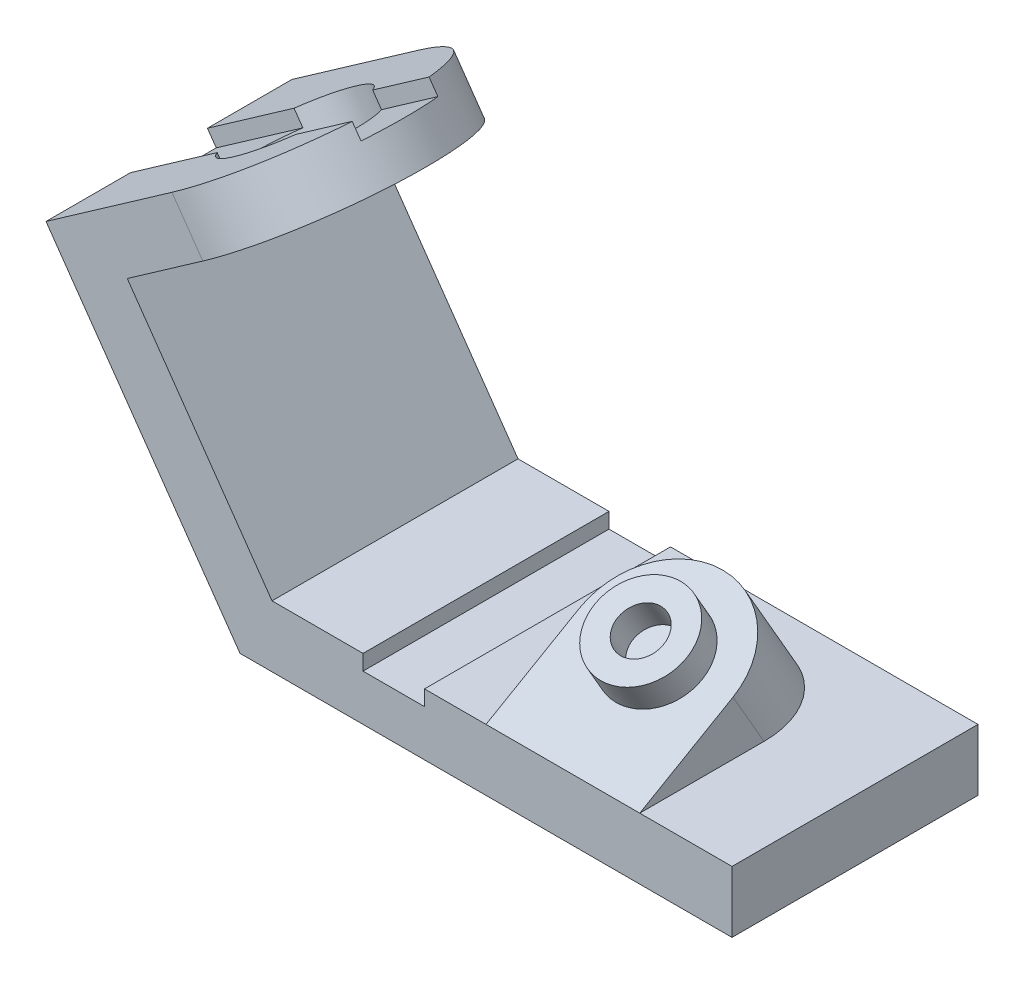
from build123d import *

# Parameters (mm, degrees)
SKETCH1_W           = 203.2
SKETCH1_H           = 25.4
BOSS_EXTRUDE1_DEPTH = 101.6
SKETCH2_W           = 25.4
SKETCH2_H           = 6.35
CUT_EXTRUDE1_DEPTH  = 229.6
BOSS_EXTRUDE2_REACH = 235.091
SKETCH4_R           = 19.05
SKETCH4_R_2         = 9.525
BOSS_EXTRUDE3_DEPTH = 12.7
BOSS_EXTRUDE4_DEPTH = 101.6
BOSS_EXTRUDE5_DEPTH = 22.225
SKETCH7_R           = 25.4
SKETCH7_R_2         = 12.7
CUT_EXTRUDE4_DEPTH  = 12.7
CUT_EXTRUDE5_REACH  = 277.657
SKETCH8_R           = 12.7
CUT_EXTRUDE6_DEPTH  = 6.35


with BuildPart() as part:
    # Sketch1 → Boss-Extrude1 (new body)
    with BuildSketch(Plane.XY):
        with Locations((-101.6, 12.7)):
            Rectangle(SKETCH1_W, SKETCH1_H)
    extrude(amount=-BOSS_EXTRUDE1_DEPTH)

    # Sketch2 → Cut-Extrude1 (cut, through all)
    with BuildSketch(Plane.XY):
        with Locations((-139.7, 22.225)):
            Rectangle(SKETCH2_W, SKETCH2_H)
    extrude(amount=-CUT_EXTRUDE1_DEPTH, mode=Mode.SUBTRACT)

    # Sketch3 → Boss-Extrude2 (add, up to next)
    with BuildSketch(Plane(origin=(0, 19.05, 10.998522628), x_dir=(-1, 0, 0), z_dir=(0, 0.866025403784438, 0.500000000000001)), mode=Mode.PRIVATE) as boss_extrude2_sk1:
        with BuildLine():
            Line((101.6, -12.7), (38.1, -12.7))
            Line((38.1, -12.7), (38.1, -57.15))
            ThreePointArc((38.1, -57.15), (69.85, -88.9), (101.6, -57.15))
            Line((101.6, -57.15), (101.6, -12.7))
        make_face()
    boss_extrude2_tool1 = extrude(boss_extrude2_sk1.sketch, amount=-BOSS_EXTRUDE2_REACH, mode=Mode.PRIVATE) - part.part
    add(boss_extrude2_tool1.solids().sort_by_distance((-69.85, 42.927534, -30.35858))[0])

    # Sketch4 → Boss-Extrude3 (add)
    with BuildSketch(Plane(origin=(0, 19.05, 10.998522628), x_dir=(1, 0, 0), z_dir=(0, 0.8660254037844382, 0.5000000000000011))):
        with Locations((-69.85, 57.15)):
            Circle(SKETCH4_R)
        with Locations((-69.85, 57.15)):
            Circle(SKETCH4_R_2, mode=Mode.SUBTRACT)
    extrude(amount=BOSS_EXTRUDE3_DEPTH)

    # Sketch5 → Boss-Extrude4 (add)
    with BuildSketch(Plane.XY):
        Polygon((-203.2, 0), (-283.328628158, 114.435540587), (-262.522166233, 129.00438207), (-182.393538075, 14.568841483), align=None)
    extrude(amount=-BOSS_EXTRUDE4_DEPTH)

    # Sketch6 → Boss-Extrude5 (add)
    with BuildSketch(Plane(origin=(-146.979381596, 209.908310859, 0), x_dir=(0.8191520442889892, 0.5735764363510499, 0), z_dir=(-0.5735764363510498, 0.8191520442889891, 0))):
        with BuildLine():
            Line((-166.4516954, 0), (-102.9516954, 0))
            ThreePointArc((-102.9516954, 0), (-52.1516954, 50.8), (-102.9516954, 101.6))
            Line((-102.9516954, 101.6), (-166.4516954, 101.6))
            Line((-166.4516954, 101.6), (-166.4516954, 0))
        make_face()
    extrude(amount=-BOSS_EXTRUDE5_DEPTH)

    # Sketch7 → Cut-Extrude4 (cut)
    with BuildSketch(Plane(origin=(-146.979381596, 209.908310859, 0), x_dir=(0.8191520442889892, 0.5735764363510499, 0), z_dir=(-0.5735764363510498, 0.8191520442889891, 0))):
        with Locations((-102.9516954, 50.8)):
            Circle(SKETCH7_R)
        with Locations((-102.9516954, 50.8)):
            Circle(SKETCH7_R_2, mode=Mode.SUBTRACT)
    extrude(amount=-CUT_EXTRUDE4_DEPTH, mode=Mode.SUBTRACT)

    # Sketch8 → Cut-Extrude5 (cut, up to next)
    with BuildSketch(Plane(origin=(-146.979381596, 209.908310859, 0), x_dir=(0.8191520442889892, 0.5735764363510499, 0), z_dir=(-0.5735764363510498, 0.8191520442889891, 0)), mode=Mode.PRIVATE) as cut_extrude5_sk1:
        with Locations((-102.9516954, 50.8)):
            Circle(SKETCH8_R)
    cut_extrude5_tool1 = extrude(cut_extrude5_sk1.sketch, amount=-CUT_EXTRUDE5_REACH, mode=Mode.PRIVATE) & part.part
    add(cut_extrude5_tool1.solids().sort_by_distance((-231.312473, 150.857644, -50.8))[0], mode=Mode.SUBTRACT)

    # Sketch9 → Cut-Extrude6 (cut)
    with BuildSketch(Plane(origin=(-146.979381596, 209.908310859, 0), x_dir=(0.8191520442889892, 0.5735764363510499, 0), z_dir=(-0.5735764363510498, 0.8191520442889891, 0))):
        with BuildLine():
            ThreePointArc((-54.695873212, 34.925), (-52.1516954, 50.8), (-54.695873212, 66.675))
            Line((-54.695873212, 66.675), (-83.123826755, 66.675))
            ThreePointArc((-83.123826755, 66.675), (-77.5516954, 50.8), (-83.123826755, 34.925))
            Line((-83.123826755, 34.925), (-54.695873212, 34.925))
        make_face()
        with BuildLine():
            ThreePointArc((-122.779564044, 34.925), (-128.3516954, 50.8), (-122.779564044, 66.675))
            Line((-122.779564044, 66.675), (-166.4516954, 66.675))
            Line((-166.4516954, 66.675), (-166.4516954, 34.925))
            Line((-166.4516954, 34.925), (-122.779564044, 34.925))
        make_face()
    extrude(amount=-CUT_EXTRUDE6_DEPTH, mode=Mode.SUBTRACT)


solid = part.part
